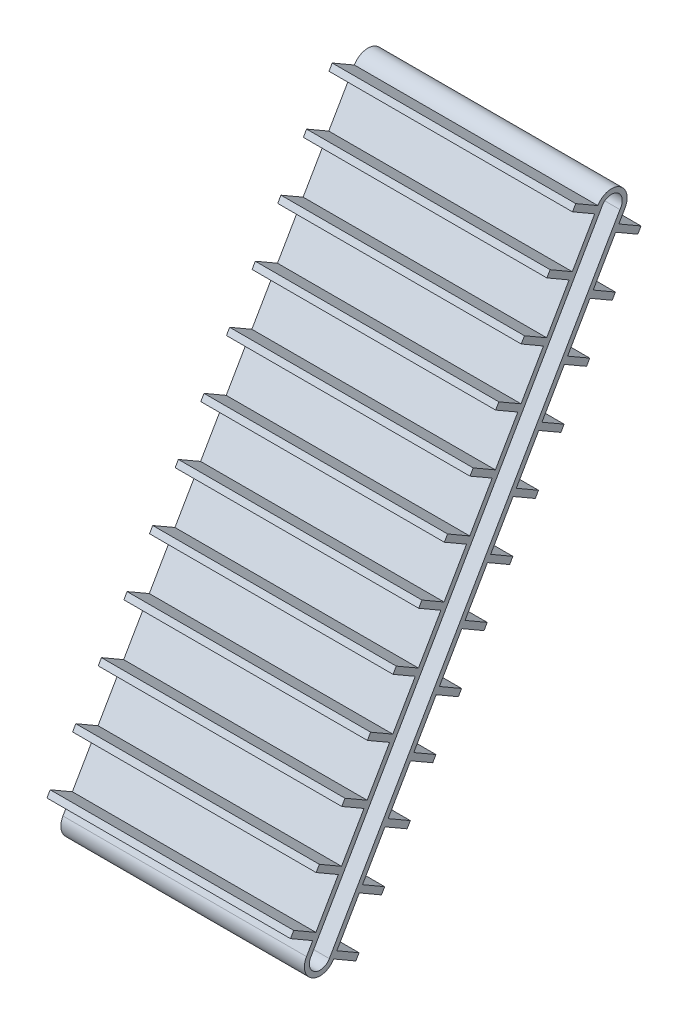
from build123d import *

# Parameters (mm, degrees)
BOSS_EXTRUDE1_DEPTH = 1140
SKETCH2_W           = 1140
SKETCH2_H           = 30
BOSS_EXTRUDE2_DEPTH = 120
LPATTERN1_COUNT     = 12
LPATTERN1_PITCH     = 240
SKETCH3_W           = 1140
SKETCH3_H           = 30
BOSS_EXTRUDE3_DEPTH = 120
LPATTERN2_COUNT     = 12
LPATTERN2_PITCH     = 240


with BuildPart() as part:
    # Sketch1 → Boss-Extrude1 (new body)
    with BuildSketch(Plane(origin=(0, 0, 0), x_dir=(0, 0, -1), z_dir=(1, 0, 0))):
        with BuildLine():
            Line((-1427.55837346, -2325.803634702), (-66.769925465, 30.485029988))
            ThreePointArc((-66.769925465, 30.485029988), (33.630684267, 65.242141869), (63.566264638, -36.7))
            Line((63.566264638, -36.7), (-1300.430336503, -2399.211414527))
            ThreePointArc((-1300.430336503, -2399.211414527), (-1400.700491121, -2426.075433124), (-1427.55837346, -2325.803634702))
        make_face()
        with BuildLine():
            Line((-1407.29787133, -2337.511414527), (-46.809262955, 18.923978297))
            ThreePointArc((-46.809262955, 18.923978297), (25.244920543, 43.725485014), (39.793277424, -31.076021703))
            Line((39.793277424, -31.076021703), (-1320.695330951, -2387.511414527))
            ThreePointArc((-1320.695330951, -2387.511414527), (-1388.996601141, -2405.812684716), (-1407.29787133, -2337.511414527))
        make_face(mode=Mode.SUBTRACT)
    extrude(amount=BOSS_EXTRUDE1_DEPTH)

    # Sketch2 → Boss-Extrude2 (add)
    with BuildSketch(Plane(origin=(0, 36.540800081, 63.272636652), x_dir=(1, 0, 0), z_dir=(0, 0.5001059921576408, 0.8659642005348847))):
        with Locations((570, -15)):
            Rectangle(SKETCH2_W, SKETCH2_H)
    boss_extrude2 = extrude(amount=BOSS_EXTRUDE2_DEPTH)

    # LPattern1: Boss-Extrude2 ×12
    with Locations(*[Vector(0, -0.8659642005348845, 0.5001059921576408) * (i * LPATTERN1_PITCH) for i in range(1, LPATTERN1_COUNT)]):
        add(boss_extrude2)

    # Sketch3 → Boss-Extrude3 (add)
    with BuildSketch(Plane(origin=(0, -36.7, -63.566264638), x_dir=(-1, 0, 0), z_dir=(0, -0.49999999999999756, -0.86602540378444))):
        with Locations((-570, -2712.993202281)):
            Rectangle(SKETCH3_W, SKETCH3_H)
    boss_extrude3 = extrude(amount=BOSS_EXTRUDE3_DEPTH)

    # LPattern2: Boss-Extrude3 ×12
    with Locations(*[Vector(0, 0.86602540378444, -0.49999999999999767) * (i * LPATTERN2_PITCH) for i in range(1, LPATTERN2_COUNT)]):
        add(boss_extrude3)


solid = part.part
